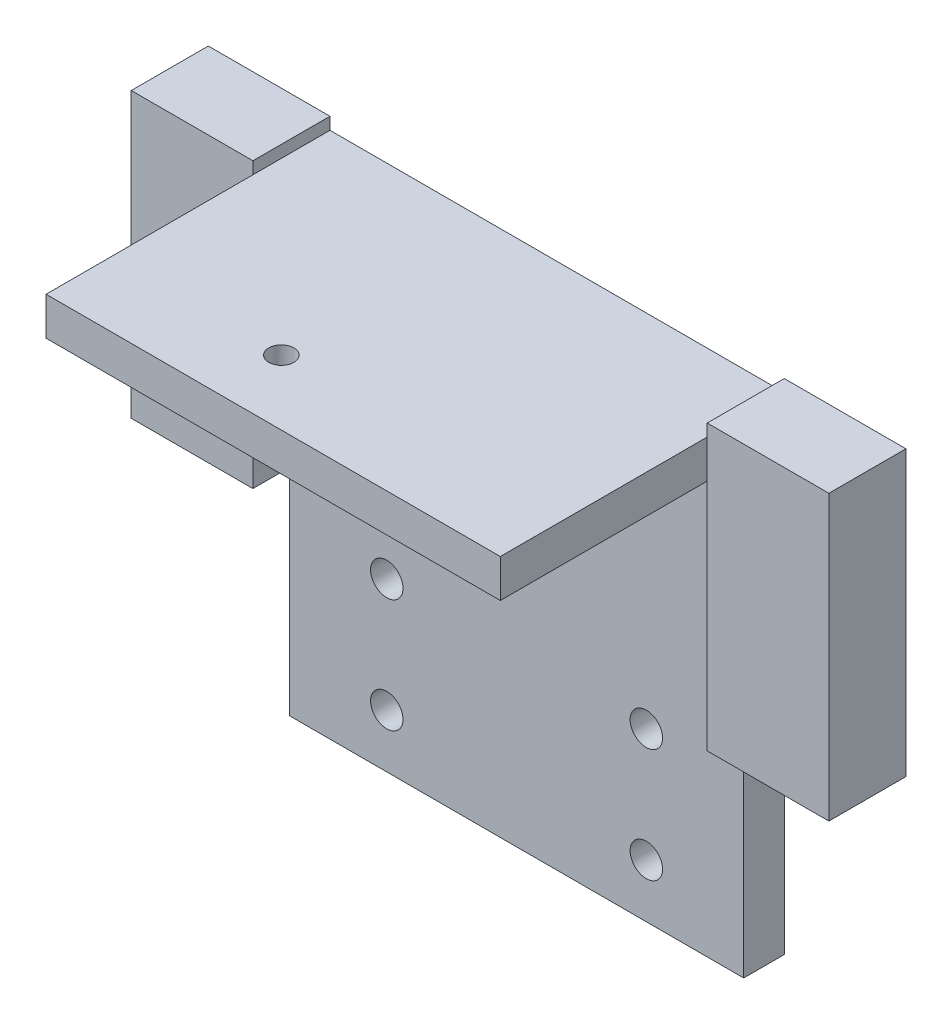
from build123d import *

# Parameters (mm, degrees)
SKETCH_1_W          = 56
SKETCH_1_H          = 60
EXTRUDE_1_DEPTH     = 5
SKETCH_2_R          = 2
CUT_EXTRUDE_1_DEPTH = 5
SKETCH_3_W          = 56
SKETCH_3_H          = 4.7
EXTRUDE_2_DEPTH     = 30
SKETCH_4_R          = 1.55
CUT_EXTRUDE_2_DEPTH = 40
SKETCH_5_W          = 25
SKETCH_5_H          = 24
EXTRUDE_3_DEPTH     = 4.3
EXTRUDE_4_DEPTH     = 15


with BuildPart() as part:
    # 草图1 → 凸台-拉伸1 (new body)
    with BuildSketch(Plane.XY):
        Rectangle(SKETCH_1_W, SKETCH_1_H)
    extrude(amount=EXTRUDE_1_DEPTH)

    # 草图2 → 切除-拉伸1 (cut)
    with BuildSketch(Plane.XY.offset(5)):
        with Locations((-16, -23.4)):
            Circle(SKETCH_2_R)
        with Locations((-16, -9.4)):
            Circle(SKETCH_2_R)
    cut_extrude_1 = extrude(amount=-CUT_EXTRUDE_1_DEPTH, mode=Mode.SUBTRACT)

    # 镜向1: 切除-拉伸1 across plane
    add(cut_extrude_1.mirror(Plane(origin=(0, 0, 0), x_dir=(0, 0, 1), z_dir=(1, 0, 0))), mode=Mode.SUBTRACT)

    # 草图3 → 凸台-拉伸2 (add)
    with BuildSketch(Plane.XY.offset(5)):
        with Locations((0, 27.65)):
            Rectangle(SKETCH_3_W, SKETCH_3_H)
    extrude(amount=EXTRUDE_2_DEPTH)

    # 草图4 → 切除-拉伸2 (cut)
    with BuildSketch(Plane(origin=(0, 30, 0), x_dir=(1, 0, 0), z_dir=(0, 1, 0))):
        with Locations(Location((-7, -27, 0), (0, 0, 270))):
            Circle(SKETCH_4_R)
    extrude(amount=-CUT_EXTRUDE_2_DEPTH, mode=Mode.SUBTRACT)

    # 草图5 → 凸台-拉伸3 (add)
    with BuildSketch(Plane.XY.offset(5)):
        with Locations((-15.5, 13.3)):
            Rectangle(SKETCH_5_W, SKETCH_5_H)
    extrude(amount=EXTRUDE_3_DEPTH)

    # 草图6 → 凸台-拉伸4 (add)
    with BuildSketch(Plane.ZY.offset(28)):
        Polygon((0, 26.5), (0, -3.5), (9.5, -3.5), (9.5, 31.5), (0, 31.5), align=None)
    extrude_4 = extrude(amount=EXTRUDE_4_DEPTH)

    # 镜向2: 凸台-拉伸4 across plane
    add(extrude_4.mirror(Plane(origin=(0, 0, 0), x_dir=(0, 0, 1), z_dir=(1, 0, 0))))


solid = part.part
